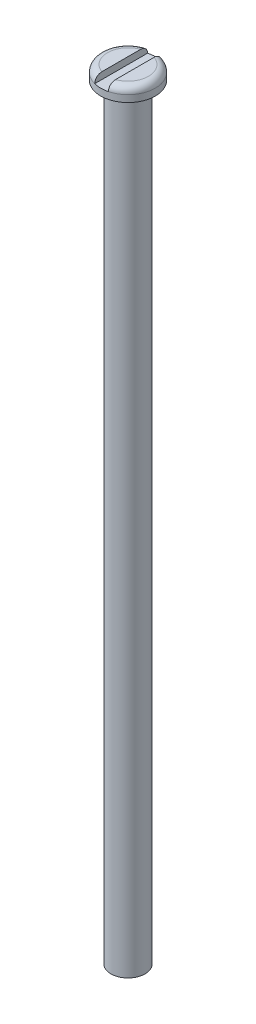
from build123d import *

# Parameters (mm, degrees)
SKETCH2_W          = 1
SKETCH2_H          = 8
CUT_EXTRUDE1_DEPTH = 0.5


with BuildPart() as part:
    # Sketch1 → Revolve1 (revolve)
    with BuildSketch(Plane.XY):
        with BuildLine():
            Line((0, -28.5), (1.25, -28.5))
            Line((1.25, -28.5), (1.25, 27.5))
            Line((1.25, 27.5), (2, 27.5))
            Line((2, 27.5), (2, 28))
            ThreePointArc((2, 28), (1.853553391, 28.353553391), (1.5, 28.5))
            Line((1.5, 28.5), (0, 28.5))
            Line((0, 28.5), (0, -28.5))
        make_face()
    revolve(axis=Axis((0, -28.5, 0), (0, 1, 0)))

    # Sketch2 → Cut-Extrude1 (cut)
    with BuildSketch(Plane(origin=(0, 28.5, 0), x_dir=(1, 0, 0), z_dir=(0, 1, 0))):
        Rectangle(SKETCH2_W, SKETCH2_H)
    extrude(amount=-CUT_EXTRUDE1_DEPTH, mode=Mode.SUBTRACT)


solid = part.part
